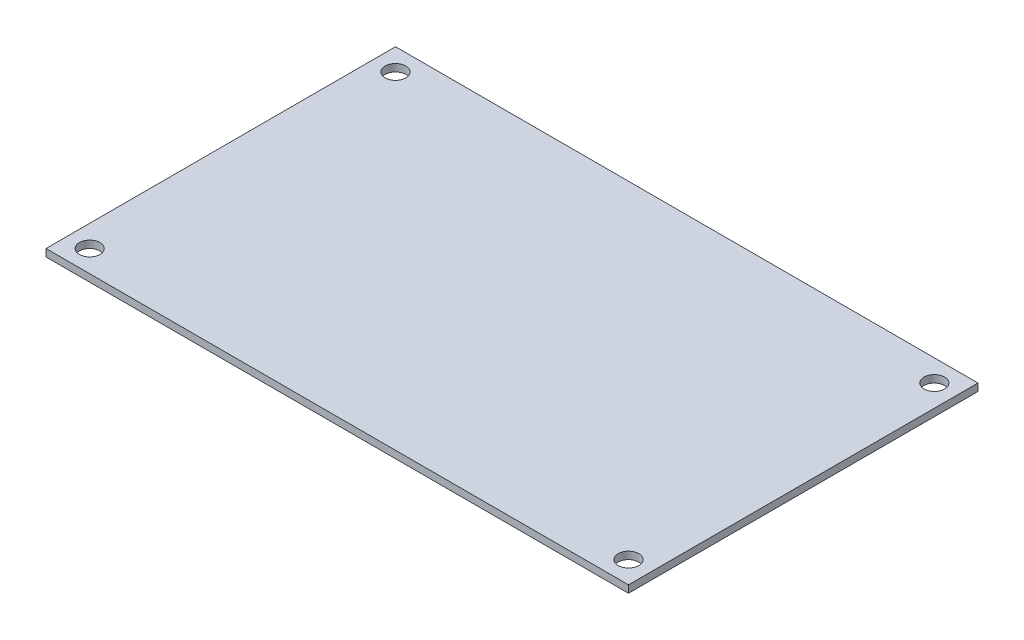
from build123d import *

# Parameters (mm, degrees)
SKETCH1_W                = 127
SKETCH1_H                = 76.2
BOSS_EXTRUDE1_DEPTH      = 1.6
M4_CLEARANCE_HOLE1_D     = 4.5
M4_CLEARANCE_HOLE1_DEPTH = 50
M4_CLEARANCE_HOLE1_TIP   = 1.351936393


with BuildPart() as part:
    # Sketch1 → Boss-Extrude1 (new body)
    with BuildSketch(Plane(origin=(0, 0, 0), x_dir=(1, 0, 0), z_dir=(0, 1, 0))):
        Rectangle(SKETCH1_W, SKETCH1_H)
    extrude(amount=BOSS_EXTRUDE1_DEPTH)

    # M4 Clearance Hole1
    with Locations(Plane(origin=(0, 1.6, 0), x_dir=(1, 0, 0), z_dir=(0, 1, 0))):
        with Locations((-58.7375, 33.3375), (-58.7375, -33.3375), (58.7375, -33.3375), (58.7375, 33.3375)):
            Hole(M4_CLEARANCE_HOLE1_D / 2, depth=M4_CLEARANCE_HOLE1_DEPTH)
            with Locations((0, 0, -(M4_CLEARANCE_HOLE1_DEPTH + M4_CLEARANCE_HOLE1_TIP / 2))):  # 118° drill point
                Cone(0, M4_CLEARANCE_HOLE1_D / 2, M4_CLEARANCE_HOLE1_TIP, mode=Mode.SUBTRACT)


solid = part.part
